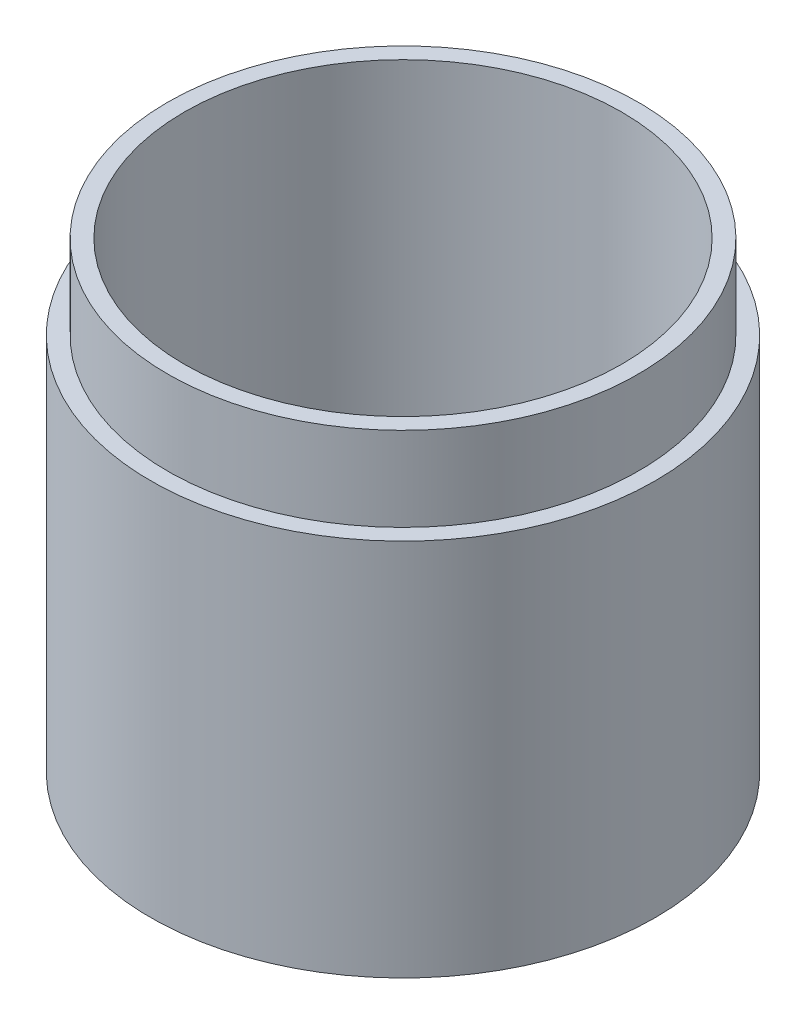
from build123d import *


with BuildPart() as part:
    # Sketch1 → Revolve1 (revolve)
    with BuildSketch(Plane.XY, mode=Mode.PRIVATE) as revolve1_sk:
        Polygon((0, 0), (38.1, 0), (38.1, 57.15), (35.56, 57.15), (35.56, 69.85), (33.02, 69.85), (33.02, 5.08), (0, 5.08), align=None)
    revolve(revolve1_sk.sketch.rotate(Axis((0, 5.08, 0), (0, -1, 0)), 180), axis=Axis((0, 5.08, 0), (0, -1, 0)))


solid = part.part
